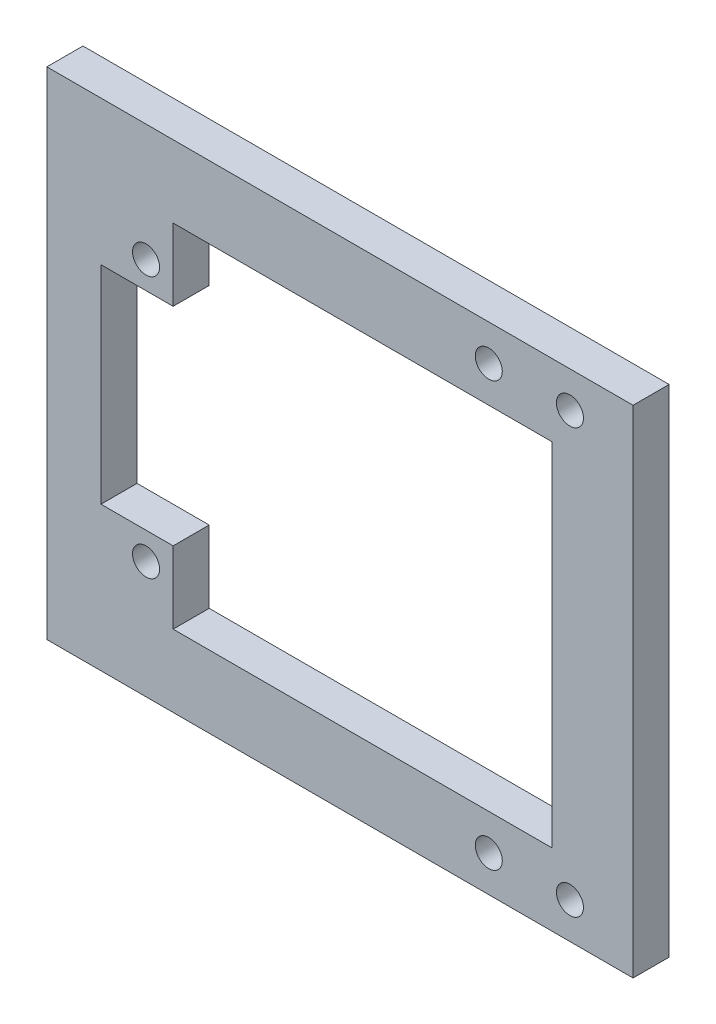
from build123d import *

# Parameters (mm, degrees)
SKETCH_1_W      = 65
SKETCH_1_H      = 55
SKETCH_1_R      = 1.5
EXTRUDE_1_DEPTH = 4


with BuildPart() as part:
    # 草图1 → 凸台-拉伸1 (new body)
    with BuildSketch(Plane.XY):
        Rectangle(SKETCH_1_W, SKETCH_1_H)
        with Locations((-21.5, 14.5)):
            Circle(SKETCH_1_R, mode=Mode.SUBTRACT)
        with Locations((-21.5, -14.5)):
            Circle(SKETCH_1_R, mode=Mode.SUBTRACT)
        with Locations((16.5, 23.5)):
            Circle(SKETCH_1_R, mode=Mode.SUBTRACT)
        with Locations((25.5, 23.5)):
            Circle(SKETCH_1_R, mode=Mode.SUBTRACT)
        with Locations((16.5, -23.5)):
            Circle(SKETCH_1_R, mode=Mode.SUBTRACT)
        with Locations((25.5, -23.5)):
            Circle(SKETCH_1_R, mode=Mode.SUBTRACT)
        Polygon((23.5, -19.5), (23.5, 19.5), (-18.5, 19.5), (-18.5, 11.5), (-26.5, 11.5), (-26.5, -11.5), (-18.5, -11.5), (-18.5, -19.5), align=None, mode=Mode.SUBTRACT)
    extrude(amount=EXTRUDE_1_DEPTH)


solid = part.part
